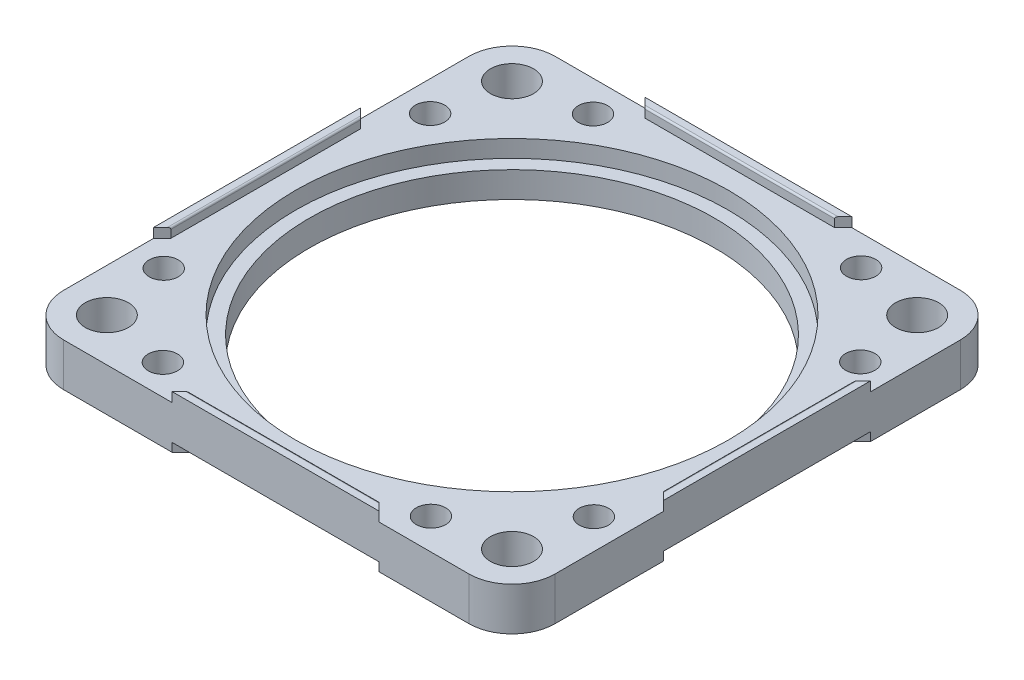
from build123d import *

# Parameters (mm, degrees)
BOSS_EXTRUDE1_DEPTH = 5
SKETCH2_R           = 1.7
SKETCH2_R_2         = 2.5
CUT_EXTRUDE3_DEPTH  = 5
SKETCH5_R           = 23.5
CUT_EXTRUDE5_DEPTH  = 41.614036982
SKETCH5_3_R         = 25.1
SKETCH5_3_R_2       = 23.5
CUT_EXTRUDE6_DEPTH  = 2
CUT_EXTRUDE7_START  = -2.5
SKETCH6_R           = 1.7
CUT_EXTRUDE7_DEPTH  = 2.5
BOSS_EXTRUDE2_DEPTH = 1.1
CUT_EXTRUDE8_DEPTH  = 1
CIRPATTERN9_COUNT   = 4
FILLET1_R           = 0.2


with BuildPart() as part:
    # Sketch1 → Boss-Extrude1 (new body)
    with BuildSketch(Plane(origin=(0, 0, 0), x_dir=(1, 0, 0), z_dir=(0, 1, 0))):
        with BuildLine():
            Line((23.5, -28.5), (-23.5, -28.5))
            ThreePointArc((-23.5, -28.5), (-27.035533906, -27.035533906), (-28.5, -23.5))
            Line((-28.5, -23.5), (-28.5, 23.5))
            ThreePointArc((-28.5, 23.5), (-27.035533906, 27.035533906), (-23.5, 28.5))
            Line((-23.5, 28.5), (23.5, 28.5))
            ThreePointArc((23.5, 28.5), (27.035533906, 27.035533906), (28.5, 23.5))
            Line((28.5, 23.5), (28.5, -23.5))
            ThreePointArc((28.5, -23.5), (27.035533906, -27.035533906), (23.5, -28.5))
        make_face()
    extrude(amount=BOSS_EXTRUDE1_DEPTH)

    # Sketch2 → Cut-Extrude3 (cut)
    with BuildSketch(Plane(origin=(0, 5, 0), x_dir=(1, 0, 0), z_dir=(0, 1, 0))):
        with Locations(Location((24.9, 15.5, 0), (0, 0, 270))):
            Circle(SKETCH2_R)
        with Locations(Location((15.5, 25, 0), (0, 0, 270))):
            Circle(SKETCH2_R)
        with Locations(Location((23.5, 23.5, 0), (0, 0, 270))):
            Circle(SKETCH2_R_2)
    cut_extrude3 = extrude(amount=-CUT_EXTRUDE3_DEPTH, mode=Mode.SUBTRACT)

    # Sketch5 → Cut-Extrude5 (cut, through all)
    with BuildSketch(Plane(origin=(0, 5, 0), x_dir=(1, 0, 0), z_dir=(0, 1, 0))):
        with Locations(Location((0, 0, 0), (0, 0, 270))):
            Circle(SKETCH5_R)
    extrude(amount=-CUT_EXTRUDE5_DEPTH, mode=Mode.SUBTRACT)

    # Sketch5<3> → Cut-Extrude6 (cut)
    with BuildSketch(Plane(origin=(0, 5, 0), x_dir=(1, 0, 0), z_dir=(0, 1, 0))):
        with Locations(Location((0, 0, 0), (0, 0, 270))):
            Circle(SKETCH5_3_R)
        with Locations(Location((0, 0, 0), (0, 0, 270))):
            Circle(SKETCH5_3_R_2, mode=Mode.SUBTRACT)
    extrude(amount=-CUT_EXTRUDE6_DEPTH, mode=Mode.SUBTRACT)

    # Sketch6 → Cut-Extrude7 (cut)
    with BuildSketch(Plane.XZ.offset(CUT_EXTRUDE7_START)):
        Polygon((22.15, -13.91228676), (22.15, -17.08771324), (24.9, -18.675426481), (27.65, -17.08771324), (27.65, -13.91228676), (24.9, -12.324573519), align=None)
        with Locations(Location((24.9, -15.5, 0), (0, 0, 90))):
            Circle(SKETCH6_R, mode=Mode.SUBTRACT)
    cut_extrude7 = extrude(amount=CUT_EXTRUDE7_DEPTH, mode=Mode.SUBTRACT)

    # Sketch7 → Boss-Extrude2 (add)
    with BuildSketch(Plane(origin=(0, 5, 0), x_dir=(1, 0, 0), z_dir=(0, 1, 0))):
        Polygon((-1.072782926, 27.5), (-1.072782926, 28.5), (-13.072782926, 28.5), (-12.072782926, 27.5), align=None)
        Polygon((9.927217074, 27.5), (10.927217074, 28.5), (-1.072782926, 28.5), (-1.072782926, 27.5), align=None)
    boss_extrude2 = extrude(amount=BOSS_EXTRUDE2_DEPTH)

    # Sketch8 → Cut-Extrude8 (cut)
    with BuildSketch(Plane.XZ):
        Polygon((-12.072782926, -27.5), (-13.072782926, -28.5), (10.927217074, -28.5), (9.927217074, -27.5), align=None)
    cut_extrude8 = extrude(amount=-CUT_EXTRUDE8_DEPTH, mode=Mode.SUBTRACT)

    # CirPattern9: Cut-Extrude3, Cut-Extrude7, Boss-Extrude2, Cut-Extrude8 ×4 about axis
    cirpattern9_axis = Axis((0, 0, 0), (0, 1, 0))
    add([cut_extrude3.rotate(cirpattern9_axis, i * 360 / CIRPATTERN9_COUNT) for i in range(1, CIRPATTERN9_COUNT)], mode=Mode.SUBTRACT)
    add([cut_extrude7.rotate(cirpattern9_axis, i * 360 / CIRPATTERN9_COUNT) for i in range(1, CIRPATTERN9_COUNT)], mode=Mode.SUBTRACT)
    add([boss_extrude2.rotate(cirpattern9_axis, i * 360 / CIRPATTERN9_COUNT) for i in range(1, CIRPATTERN9_COUNT)])
    add([cut_extrude8.rotate(cirpattern9_axis, i * 360 / CIRPATTERN9_COUNT) for i in range(1, CIRPATTERN9_COUNT)], mode=Mode.SUBTRACT)

    # Fillet1
    fillet1_edges = [part.edges().sort_by_distance(p)[0] for p in [
        (-27.5, 6.1, 1.072782926),
        (1.072782926, 6.1, 27.5),
        (27.5, 6.1, -1.072782926),
        (-1.072782926, 6.1, -27.5),
    ]]
    fillet(fillet1_edges, radius=FILLET1_R)


solid = part.part
